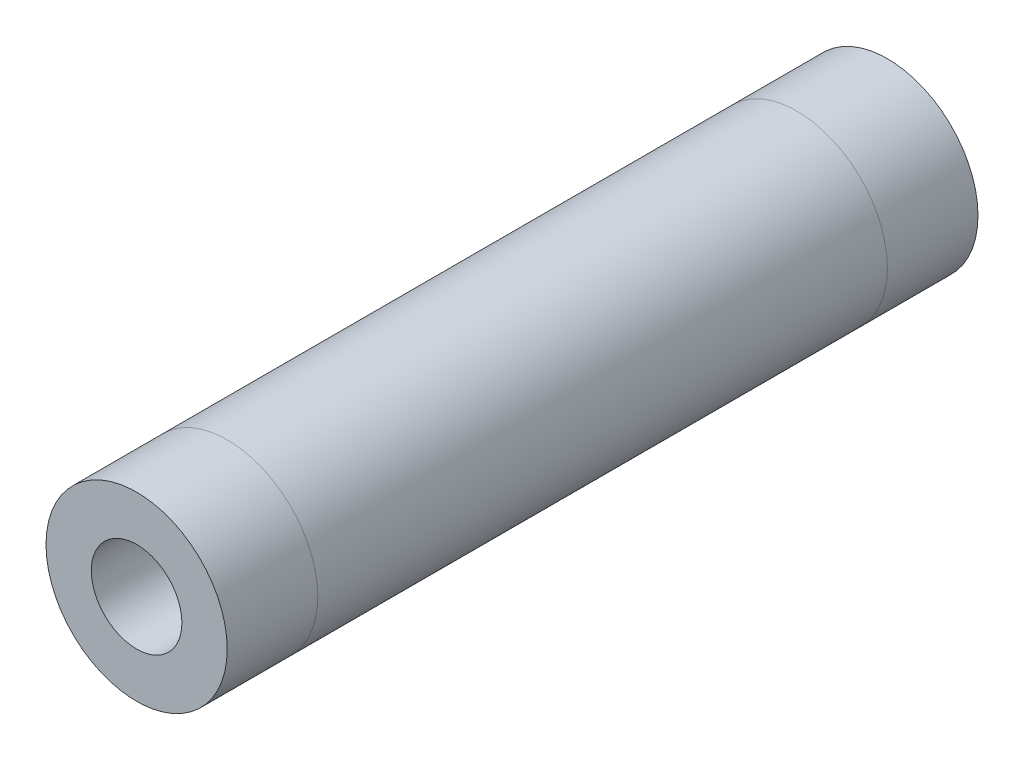
from build123d import *

# Parameters (mm, degrees)
THREADED_START            = -21.9075
SKETCH2_R                 = 6.35
SKETCH2_R_2               = 4.7625
SKETCH2_R_3               = 3.175
THREADED_INSERT_1_1_DEPTH = 6.35
THREADED_START_2          = -28.2575
SKETCH2_5_R               = 4.7625
SKETCH2_5_R_2             = 3.175
THREADED_INSERT_1_2_DEPTH = 6.35
BOSS_EXTRUDE4_START       = -74.52741
SKETCH2_7_R               = 6.35
SKETCH2_7_R_2             = 4.7625
SKETCH2_7_R_3             = 3.175
BOSS_EXTRUDE4_DEPTH       = 6.35
BOSS_EXTRUDE5_START       = -61.82741
SKETCH2_8_R               = 4.7625
SKETCH2_8_R_2             = 3.175
BOSS_EXTRUDE5_DEPTH       = 6.35
BOSS_EXTRUDE6_START       = -28.2575
SKETCH2_9_R               = 6.35
SKETCH2_9_R_2             = 4.7625
BOSS_EXTRUDE6_DEPTH       = 39.91991


with BuildPart() as part:
    # Sketch2 → Threaded Insert 1-1 (new body)
    # profile 1 of 2: a face of its own
    with BuildSketch(Plane.XY.offset(THREADED_START)):
        Circle(SKETCH2_R)
        Circle(SKETCH2_R_2, mode=Mode.SUBTRACT)
    # profile 2 of 2: a face of its own
    with BuildSketch(Plane.XY.offset(THREADED_START)):
        Circle(SKETCH2_R_2)
        Circle(SKETCH2_R_3, mode=Mode.SUBTRACT)
    extrude(amount=-THREADED_INSERT_1_1_DEPTH)

    # Sketch2<5> → Threaded Insert 1-2 (add)
    with BuildSketch(Plane.XY.offset(THREADED_START_2)):
        Circle(SKETCH2_5_R)
        Circle(SKETCH2_5_R_2, mode=Mode.SUBTRACT)
    extrude(amount=-THREADED_INSERT_1_2_DEPTH)


with BuildPart() as body_2:
    # Sketch2<7> → Boss-Extrude4 (new body)
    # profile 1 of 2: a face of its own
    with BuildSketch(Plane.XY.offset(BOSS_EXTRUDE4_START)):
        Circle(SKETCH2_7_R)
        Circle(SKETCH2_7_R_2, mode=Mode.SUBTRACT)
    # profile 2 of 2: a face of its own
    with BuildSketch(Plane.XY.offset(BOSS_EXTRUDE4_START)):
        Circle(SKETCH2_7_R_2)
        Circle(SKETCH2_7_R_3, mode=Mode.SUBTRACT)
    extrude(amount=BOSS_EXTRUDE4_DEPTH)

    # Sketch2<8> → Boss-Extrude5 (add)
    with BuildSketch(Plane.XY.offset(BOSS_EXTRUDE5_START)):
        Circle(SKETCH2_8_R)
        Circle(SKETCH2_8_R_2, mode=Mode.SUBTRACT)
    extrude(amount=-BOSS_EXTRUDE5_DEPTH)


with BuildPart() as body_3:
    # Sketch2<9> → Boss-Extrude6 (new body)
    with BuildSketch(Plane.XY.offset(BOSS_EXTRUDE6_START)):
        Circle(SKETCH2_9_R)
        Circle(SKETCH2_9_R_2, mode=Mode.SUBTRACT)
    extrude(amount=-BOSS_EXTRUDE6_DEPTH)


solid = Compound([part.part, body_2.part, body_3.part])
